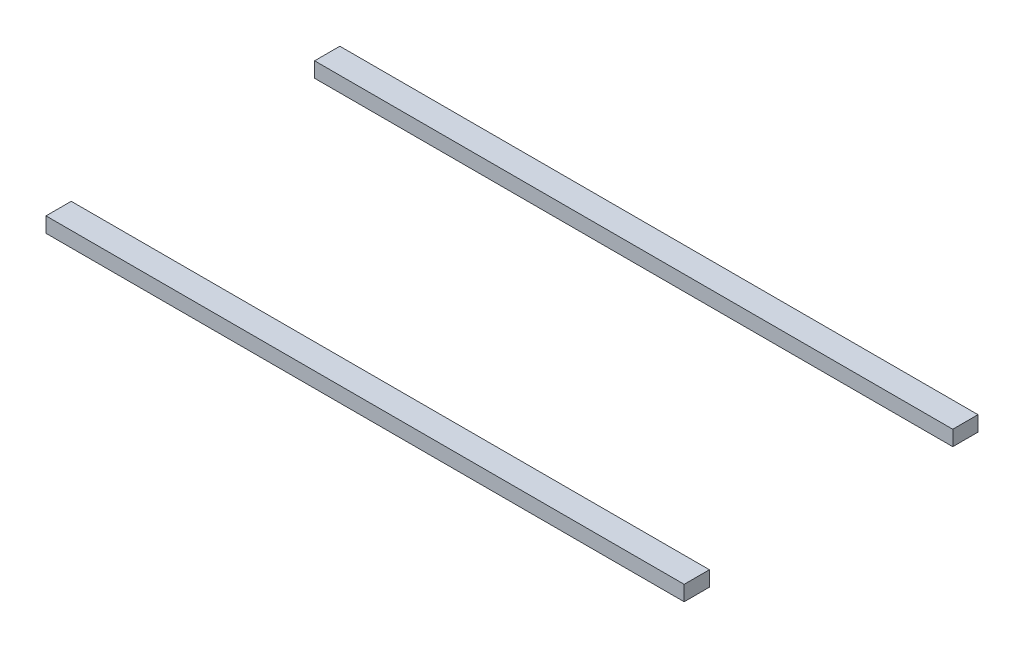
from build123d import *

# Parameters (mm, degrees)
CROQUIS1_W                = 1264
CROQUIS1_H                = 50
SALIENTE_EXTRUIR1_DEPTH   = 30
SALIENTE_EXTRUIR1_2_DEPTH = 30


with BuildPart() as part:
    # Croquis1 → Saliente-Extruir1 (new body)
    with BuildSketch(Plane(origin=(0, 0, 0), x_dir=(1, 0, 0), z_dir=(0, 1, 0))):
        with Locations((0, -266)):
            Rectangle(CROQUIS1_W, CROQUIS1_H)
    extrude(amount=SALIENTE_EXTRUIR1_DEPTH)


with BuildPart() as body_2:
    # Croquis1 → Saliente-Extruir1 2 (new body)
    with BuildSketch(Plane(origin=(0, 0, 0), x_dir=(1, 0, 0), z_dir=(0, 1, 0))):
        with Locations((0, 266)):
            Rectangle(CROQUIS1_W, CROQUIS1_H)
    extrude(amount=SALIENTE_EXTRUIR1_2_DEPTH)


solid = Compound([part.part, body_2.part])
